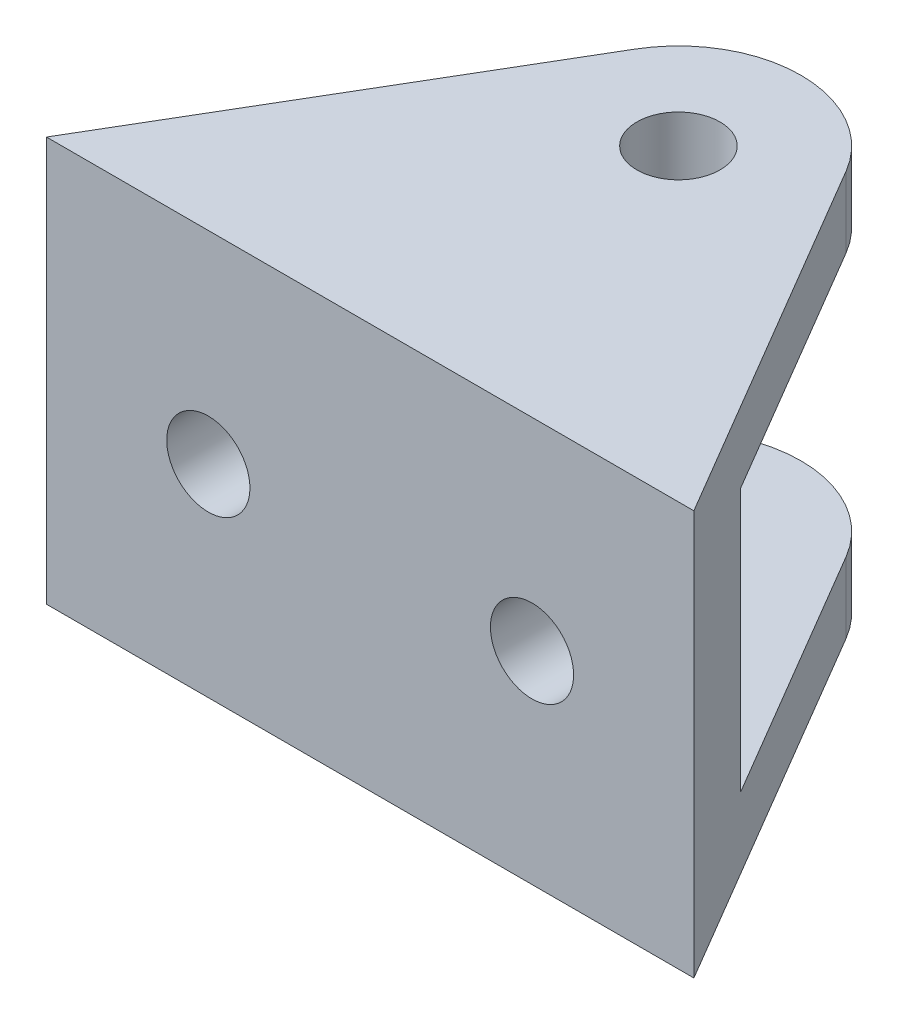
from build123d import *

# Parameters (mm, degrees)
BOSS_EXTRUDE1_DEPTH                                  = 50.8
CBORE_FOR_1_4_BINDING_HEAD_MACHINE_SCREW_D           = 6.5278
CBORE_FOR_1_4_BINDING_HEAD_MACHINE_SCREW_CBORE_D     = 14.2875
CBORE_FOR_1_4_BINDING_HEAD_MACHINE_SCREW_CBORE_DEPTH = 4.064
CUT_EXTRUDE1_REACH                                   = 75.909
SKETCH4_R                                            = 3.2639


with BuildPart() as part:
    # Sketch1 → Boss-Extrude1 (new body)
    with BuildSketch(Plane(origin=(0, 0, 0), x_dir=(0, 0, -1), z_dir=(1, 0, 0))):
        Polygon((0, 0), (0, 31.75), (43.28806111, 31.75), (43.28806111, 26.2001), (8.89, 26.2001), (8.89, 5.5499), (43.28806111, 5.5499), (43.28806111, 0), align=None)
    extrude(amount=BOSS_EXTRUDE1_DEPTH)

    # CBORE for 1/4 Binding Head Machine Screw1 (through all)
    with Locations(Plane(origin=(0, 0, -8.89), x_dir=(-1, 0, 0), z_dir=(0, 0, -1))):
        with Locations((-12.7, 15.875), (-38.1, 15.875)):
            CounterBoreHole(CBORE_FOR_1_4_BINDING_HEAD_MACHINE_SCREW_D / 2, CBORE_FOR_1_4_BINDING_HEAD_MACHINE_SCREW_CBORE_D / 2, CBORE_FOR_1_4_BINDING_HEAD_MACHINE_SCREW_CBORE_DEPTH)

    # Cut-Extrude1: up to this face of the body (flat: up to its plane)
    cut_extrude1_end = Plane(part.part.faces().sort_by_distance((25.4, 31.75, -21.644030555))[0])
    # Sketch4 → Cut-Extrude1 (cut, up to the picked face)
    with BuildSketch(Plane.XZ, mode=Mode.PRIVATE) as cut_extrude1_sk1:
        with Locations(Location((25.4, -24.188970368, 0), (0, 0, 270))):
            Circle(SKETCH4_R)
    cut_extrude1_tool1 = split(extrude(cut_extrude1_sk1.sketch, amount=-CUT_EXTRUDE1_REACH, mode=Mode.PRIVATE), bisect_by=cut_extrude1_end, keep=Keep.BOTH, mode=Mode.PRIVATE)
    # Sketch4 → Cut-Extrude1 (cut, up to the picked face)
    with BuildSketch(Plane.XZ, mode=Mode.PRIVATE) as cut_extrude1_sk2:
        with BuildLine():
            Line((17.115609678, -29.067079653), (0, 0))
            Line((0, 0), (0, -43.28806111))
            Line((0, -43.28806111), (50.8, -43.28806111))
            Line((50.8, -43.28806111), (50.8, 0))
            Line((50.8, 0), (33.684390322, -29.067079653))
            ThreePointArc((33.684390322, -29.067079653), (25.4, -33.802870368), (17.115609678, -29.067079653))
        make_face()
    cut_extrude1_tool2 = split(extrude(cut_extrude1_sk2.sketch, amount=-CUT_EXTRUDE1_REACH, mode=Mode.PRIVATE), bisect_by=cut_extrude1_end, keep=Keep.BOTH, mode=Mode.PRIVATE)
    add(cut_extrude1_tool1.solids().sort_by(Axis((25.4, 0, -24.18897), (0, 1, 0)))[0], mode=Mode.SUBTRACT)
    add(cut_extrude1_tool2.solids().sort_by(Axis((7.982682, 0, -14.87219), (0, 1, 0)))[0], mode=Mode.SUBTRACT)


solid = part.part
